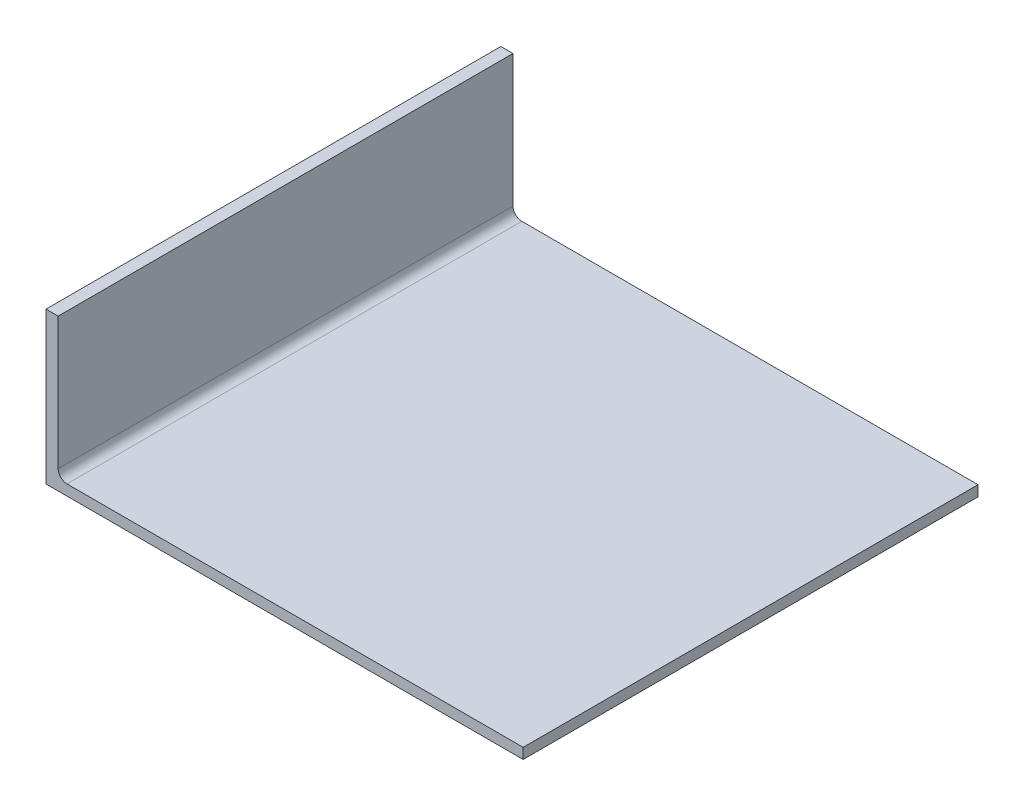
from build123d import *

# Parameters (mm, degrees)
SKETCH1_W           = 270.887813212
SKETCH1_H           = 258.221174697
BASE_DEPTH          = 6
SKETCH2_W           = 6.892214754
SKETCH2_H           = 258.221174697
BOSS_EXTRUDE2_DEPTH = 80
FILLET1_R           = 5


with BuildPart() as part:
    # Sketch1 → Base (new body)
    with BuildSketch(Plane(origin=(0, 0, 0), x_dir=(1, 0, 0), z_dir=(0, 1, 0))):
        with Locations((-126.688596317, -107.886320424)):
            Rectangle(SKETCH1_W, SKETCH1_H)
    extrude(amount=BASE_DEPTH)

    # Sketch2 → Boss-Extrude2 (add)
    with BuildSketch(Plane(origin=(0, 6, 0), x_dir=(1, 0, 0), z_dir=(0, 1, 0))):
        with Locations((-258.686395546, -107.886320424)):
            Rectangle(SKETCH2_W, SKETCH2_H)
    extrude(amount=BOSS_EXTRUDE2_DEPTH)

    # Fillet1
    fillet1_edges = [part.edges().sort_by_distance(p)[0] for p in [
        (-255.240288169, 6, 107.886320423),
    ]]
    fillet(fillet1_edges, radius=FILLET1_R)


solid = part.part
